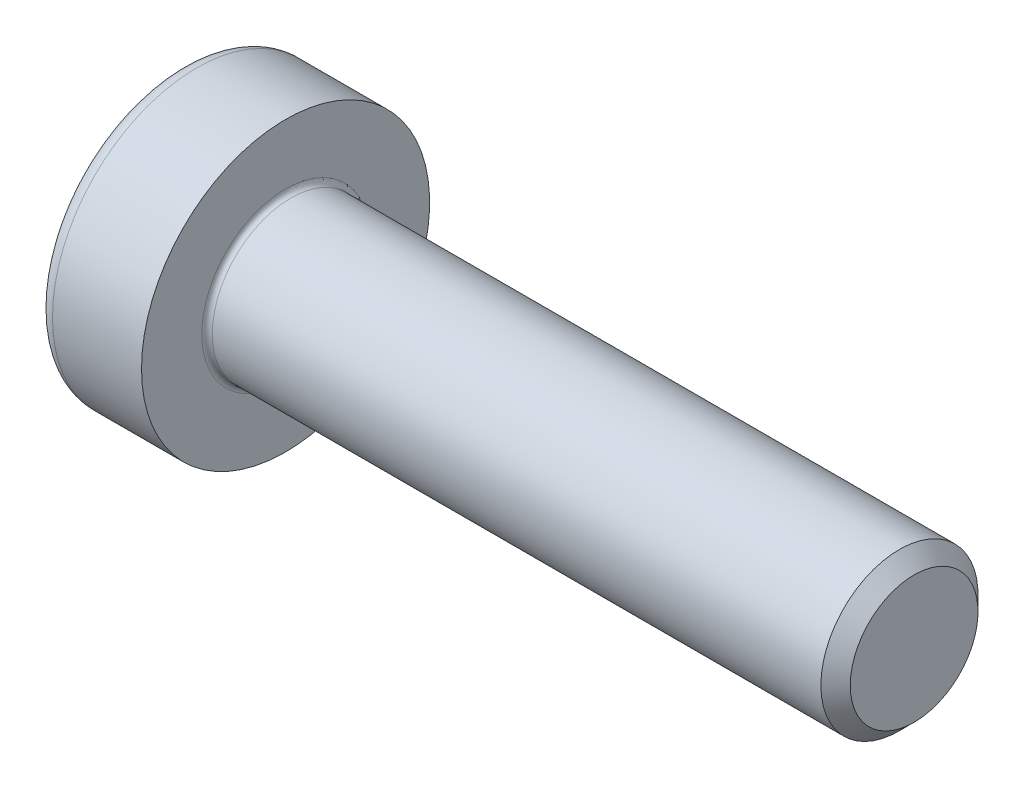
from build123d import *

# Parameters (mm, degrees)
FILLET1_R   = 0.1
FILLET2_R   = 0.3
HEX_2_DEPTH = 1.5


with BuildPart() as part:
    # BodySke → Base-Revolve (revolve)
    with BuildSketch(Plane.XY, mode=Mode.PRIVATE) as base_revolve_sk:
        Polygon((0, 0), (0, 2.75), (2, 2.75), (2, 1.5), (13.7195, 1.5), (14, 1.2195), (14, 0), align=None)
    revolve(base_revolve_sk.sketch.rotate(Axis((-31.75, 0, 0), (1, 0, 0)), 90), axis=Axis((-31.75, 0, 0), (1, 0, 0)))

    # Fillet1
    fillet1_edges = [part.edges().sort_by_distance(p)[0] for p in [
        (2, 0, -1.5),
    ]]
    fillet(fillet1_edges, radius=FILLET1_R)

    # Fillet2
    fillet2_edges = [part.edges().sort_by_distance(p)[0] for p in [
        (0, 0, -2.75),
    ]]
    fillet(fillet2_edges, radius=FILLET2_R)

    # Sketch2 → Hex-PreBroach (revolve, cut)
    with BuildSketch(Plane.XY, mode=Mode.PRIVATE) as hex_prebroach_sk:
        Polygon((0, 1), (1.5, 1), (2.077350269, 0), (0, 0), align=None)
    revolve(hex_prebroach_sk.sketch.rotate(Axis((0, 0, 0), (1, 0, 0)), 90), axis=Axis((0, 0, 0), (1, 0, 0)), mode=Mode.SUBTRACT)

    # Sketch3 → Hex 2 (cut)
    with BuildSketch(Plane(origin=(0, 0, 0), x_dir=(0, 0.500000000000001, 0.866025403784438), z_dir=(-1, 0, 0))):
        Polygon((0.577350269, 1), (-0.577350269, 1), (-1.154700538, 0), (-0.577350269, -1), (0.577350269, -1), (1.154700538, 0), align=None)
    extrude(amount=-HEX_2_DEPTH, mode=Mode.SUBTRACT)


solid = part.part
